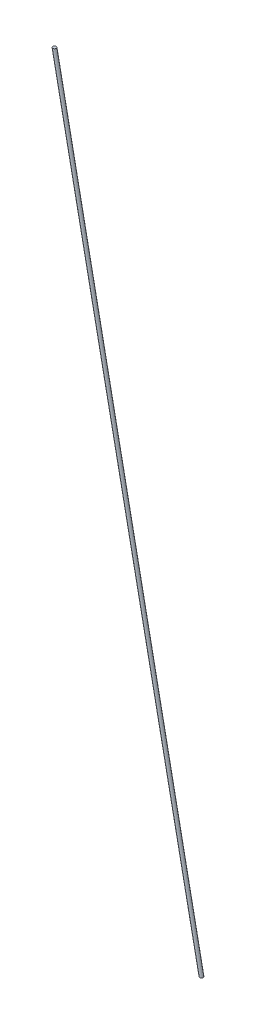
from build123d import *

# Parameters (mm, degrees)
SKETCH2_R = 2


with BuildPart() as part:
    # Sweep1: sweep along a path in Sketch1
    with BuildLine(Plane.XY) as sweep1_path:
        Line((0, 0), (171.128500824, -851.29324547))
    # Sketch2 → Sweep1 (sweep)
    with BuildSketch(Plane(origin=(0, 0, 0), x_dir=(1, 0, 0), z_dir=(0, 1, 0))):
        Circle(SKETCH2_R)
    sweep(path=sweep1_path.line)


solid = part.part
